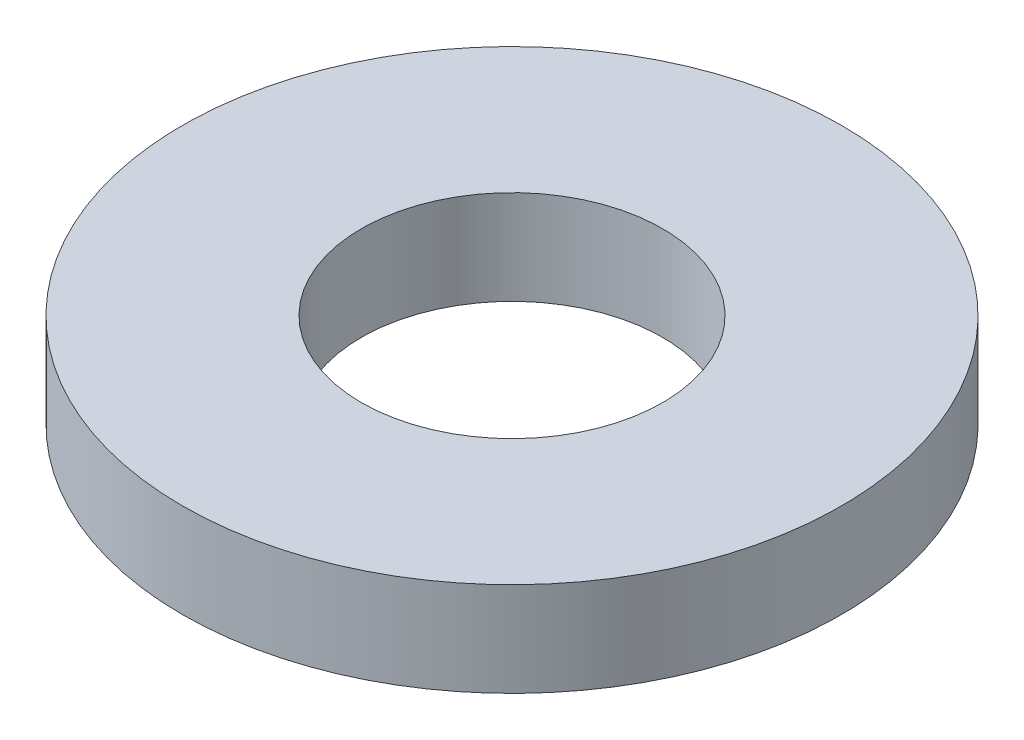
from build123d import *

# Parameters (mm, degrees)
SKETCH1_R           = 3.5
SKETCH1_R_2         = 1.6
BOSS_EXTRUDE1_DEPTH = 1


with BuildPart() as part:
    # Sketch1 → Boss-Extrude1 (new body)
    with BuildSketch(Plane(origin=(0, 0, 0), x_dir=(1, 0, 0), z_dir=(0, 1, 0))):
        with Locations(Location((0, 0, 0), (0, 0, 270))):
            Circle(SKETCH1_R)
        with Locations(Location((0, 0, 0), (0, 0, 270))):
            Circle(SKETCH1_R_2, mode=Mode.SUBTRACT)
    extrude(amount=BOSS_EXTRUDE1_DEPTH)


solid = part.part
